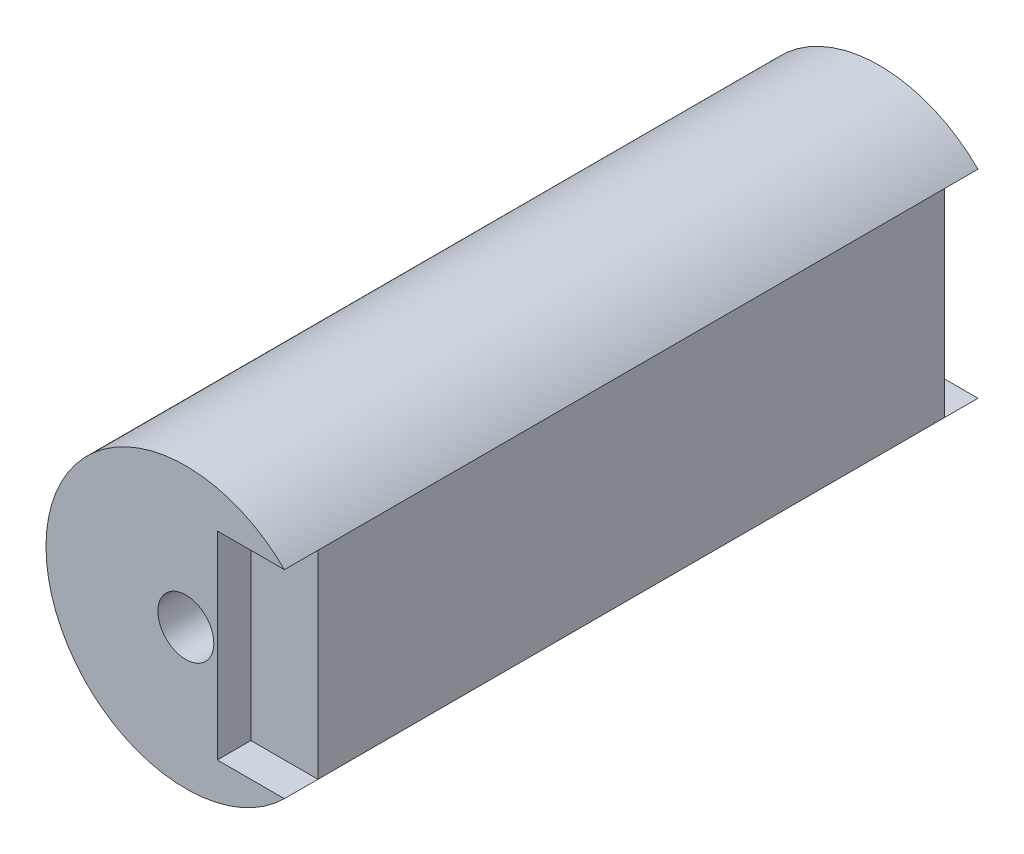
from build123d import *

# Parameters (mm, degrees)
SKETCH_1_R               = 2.5
EXTRUDE_1_DEPTH          = 88.2
SKETCH_2_R               = 12.5
EXTRUDE_2_DEPTH          = 62
SKETCH_3_W               = 40
SKETCH_3_H               = 17.730441408
SKETCH_3_R               = 5
EXTRUDE_3_DEPTH          = 3
PATTERN_LINEAR_1_COUNT   = 2
PATTERN_LINEAR_1_PITCH   = 59
CUT_EXTRUDE_1_DEPTH      = 85.347436238
CUT_EXTRUDE_1_DEPTH_BACK = 85.347436238
SKETCH_6_W               = 31.187630179
SKETCH_6_H               = 17.730441408
CUT_EXTRUDE_7_DEPTH      = 6
PATTERN_LINEAR_3_COUNT   = 2
PATTERN_LINEAR_3_PITCH   = 59
CUT_EXTRUDE_8_DEPTH      = 92.595344354
SKETCH_10_W              = 11.2
SKETCH_10_H              = 5
CUT_EXTRUDE_9_DEPTH      = 78.257408107
SKETCH_11_R              = 2.5
CUT_EXTRUDE_10_DEPTH     = 65.470923679


with BuildPart() as part:
    # 草图1 → 凸台-拉伸1 (new body)
    with BuildSketch(Plane.XY):
        Circle(SKETCH_1_R)
    extrude(amount=EXTRUDE_1_DEPTH)

    # 草图2 → 凸台-拉伸2 (add)
    with BuildSketch(Plane.XY.offset(73.2)):
        Circle(SKETCH_2_R)
    extrude(amount=-EXTRUDE_2_DEPTH)

    # 草图3 → 凸台-拉伸3 (add)
    with BuildSketch(Plane.XY.offset(73.2)):
        with Locations((20, 0)):
            Rectangle(SKETCH_3_W, SKETCH_3_H)
        with Locations((32.640039451, 0)):
            Circle(SKETCH_3_R, mode=Mode.SUBTRACT)
    extrude_3 = extrude(amount=-EXTRUDE_3_DEPTH)

    # 阵列(线性)1: 凸台-拉伸3 ×2
    with Locations(*[(0, 0, -i * PATTERN_LINEAR_1_PITCH) for i in range(1, PATTERN_LINEAR_1_COUNT)]):
        add(extrude_3)

    # 草图6 → 切除-拉伸1 (cut, two sides: drawn at the far end of the back side and taken through both)
    with BuildSketch(Plane.XY.offset(73.2).offset(-CUT_EXTRUDE_1_DEPTH_BACK)):
        with Locations((24.406184911, 0)):
            Rectangle(SKETCH_6_W, SKETCH_6_H)
    extrude(amount=CUT_EXTRUDE_1_DEPTH + CUT_EXTRUDE_1_DEPTH_BACK, mode=Mode.SUBTRACT)

    # 草图8 → 切除-拉伸7 (cut)
    with BuildSketch(Plane(origin=(8.812369821, 0, 0), x_dir=(0, 0, -1), z_dir=(1, 0, 0))):
        Polygon((-70.2, 8.865220704), (-72.620989075, 8.865220704), (-73.2, 8.865220704), (-73.2, 6.367777059), (-73.2, -8.865220704), (-70.2, -8.865220704), align=None)
    cut_extrude_7 = extrude(amount=-CUT_EXTRUDE_7_DEPTH, mode=Mode.SUBTRACT)

    # 阵列(线性)3: 切除-拉伸7 ×2
    with Locations(*[(0, 0, -i * PATTERN_LINEAR_3_PITCH) for i in range(1, PATTERN_LINEAR_3_COUNT)]):
        add(cut_extrude_7, mode=Mode.SUBTRACT)

    # 草图9 → 切除-拉伸8 (cut, through all)
    with BuildSketch(Plane(origin=(8.812369821, 0, 0), x_dir=(0, 0, -1), z_dir=(1, 0, 0))):
        Polygon((-73.2, -2.531338833), (-73.2, 2.528560393), (-88.2, 2.5), (-88.2, -2.5), align=None)
    extrude(amount=-CUT_EXTRUDE_8_DEPTH, mode=Mode.SUBTRACT)

    # 草图10 → 切除-拉伸9 (cut, through all)
    with BuildSketch(Plane(origin=(8.812369821, 0, 0), x_dir=(0, 0, -1), z_dir=(1, 0, 0))):
        with Locations((-5.6, 0)):
            Rectangle(SKETCH_10_W, SKETCH_10_H)
    extrude(amount=-CUT_EXTRUDE_9_DEPTH, mode=Mode.SUBTRACT)

    # 草图11 → 切除-拉伸10 (cut, through all)
    with BuildSketch(Plane.XY.offset(73.2)):
        Circle(SKETCH_11_R)
    extrude(amount=-CUT_EXTRUDE_10_DEPTH, mode=Mode.SUBTRACT)


solid = part.part
